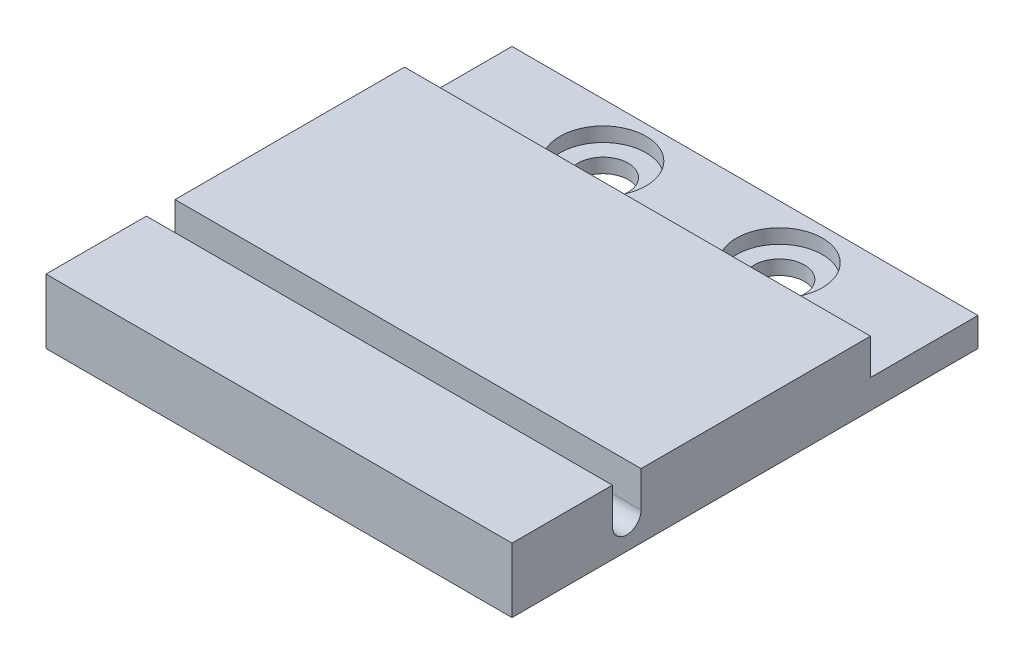
from build123d import *

# Parameters (mm, degrees)
SKETCH_1_W          = 65
SKETCH_1_H          = 65
EXTRUDE_1_DEPTH     = 4
SKETCH_2_R          = 3.5
CUT_EXTRUDE_1_DEPTH = 47.135669498
SKETCH_3_R          = 6
CUT_EXTRUDE_2_DEPTH = 2
SKETCH_4_W          = 65
SKETCH_4_H          = 50
EXTRUDE_2_DEPTH     = 5
SKETCH_5_W          = 4
SKETCH_5_H          = 5
CUT_EXTRUDE_3_DEPTH = 74.227385588
SKETCH_6_R          = 2
CUT_EXTRUDE_4_DEPTH = 74.227385588


with BuildPart() as part:
    # 草图1 → 凸台-拉伸1 (new body)
    with BuildSketch(Plane(origin=(0, 0, 0), x_dir=(1, 0, 0), z_dir=(0, 1, 0))):
        Rectangle(SKETCH_1_W, SKETCH_1_H)
    extrude(amount=EXTRUDE_1_DEPTH)

    # 草图2 → 切除-拉伸1 (cut, through all)
    with BuildSketch(Plane(origin=(0, 4, 0), x_dir=(1, 0, 0), z_dir=(0, 1, 0))):
        with Locations(Location((-12.3, 25, 0), (0, 0, 270))):
            Circle(SKETCH_2_R)
        with Locations(Location((12.3, 25, 0), (0, 0, 270))):
            Circle(SKETCH_2_R)
    extrude(amount=-CUT_EXTRUDE_1_DEPTH, mode=Mode.SUBTRACT)

    # 草图3 → 切除-拉伸2 (cut)
    with BuildSketch(Plane(origin=(0, 4, 0), x_dir=(1, 0, 0), z_dir=(0, 1, 0))):
        with Locations(Location((-12.3, 25, 0), (0, 0, 270))):
            Circle(SKETCH_3_R)
        with Locations(Location((12.3, 25, 0), (0, 0, 270))):
            Circle(SKETCH_3_R)
    extrude(amount=-CUT_EXTRUDE_2_DEPTH, mode=Mode.SUBTRACT)

    # 草图4 → 凸台-拉伸2 (add)
    with BuildSketch(Plane(origin=(0, 4, 0), x_dir=(1, 0, 0), z_dir=(0, 1, 0))):
        with Locations((0, -7.5)):
            Rectangle(SKETCH_4_W, SKETCH_4_H)
    extrude(amount=EXTRUDE_2_DEPTH)

    # 草图5 → 切除-拉伸3 (cut, through all)
    with BuildSketch(Plane(origin=(32.5, 0, 0), x_dir=(0, 0, -1), z_dir=(1, 0, 0))):
        with Locations((-16.5, 6.5)):
            Rectangle(SKETCH_5_W, SKETCH_5_H)
    extrude(amount=-CUT_EXTRUDE_3_DEPTH, mode=Mode.SUBTRACT)

    # 草图6 → 切除-拉伸4 (cut, through all)
    with BuildSketch(Plane(origin=(32.5, 0, 0), x_dir=(0, 0, -1), z_dir=(1, 0, 0))):
        with Locations((-16.5, 4)):
            Circle(SKETCH_6_R)
    extrude(amount=-CUT_EXTRUDE_4_DEPTH, mode=Mode.SUBTRACT)


solid = part.part
